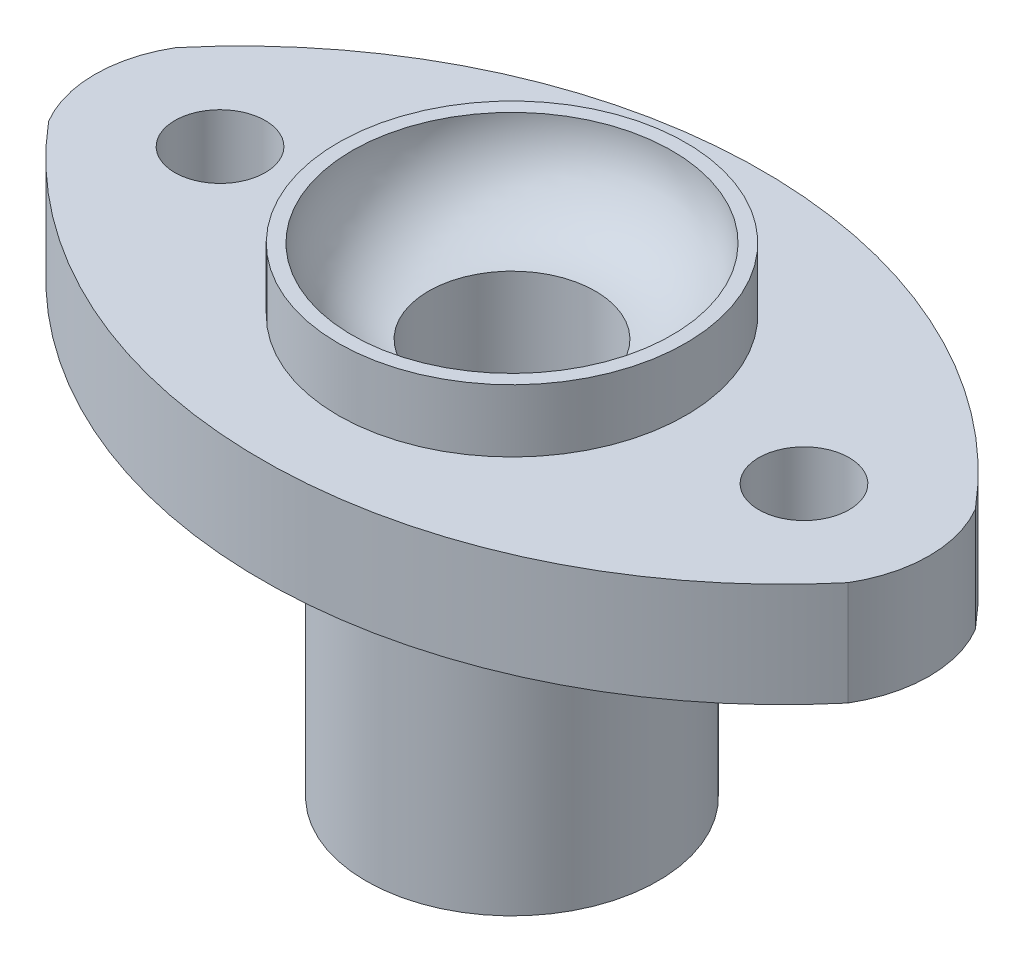
from build123d import *

# Parameters (mm, degrees)
SKETCH1_R           = 21
BOSS_EXTRUDE1_DEPTH = 45
SKETCH2_R           = 6.5
BOSS_EXTRUDE2_DEPTH = 15
SKETCH3_R           = 25
BOSS_EXTRUDE3_DEPTH = 9
CUT_EXTRUDE1_REACH  = 92.25
SKETCH5_R           = 12
CHAMFER1_SIZE       = 2.5
CHAMFER1_SIZE2      = 0.669872981


with BuildPart() as part:
    # Sketch1 → Boss-Extrude1 (new body)
    with BuildSketch(Plane(origin=(0, 0, 0), x_dir=(1, 0, 0), z_dir=(0, 1, 0))):
        with Locations(Location((0, 0, 0), (0, 0, 90))):
            Circle(SKETCH1_R)
    extrude(amount=BOSS_EXTRUDE1_DEPTH)

    # Sketch2 → Boss-Extrude2 (add)
    with BuildSketch(Plane(origin=(0, 45, 0), x_dir=(1, 0, 0), z_dir=(0, 1, 0))):
        with BuildLine():
            ThreePointArc((-57.496195447, -9.157943365), (-60, 0), (-57.496195447, 9.157943365))
            ThreePointArc((-57.496195447, 9.157943365), (0, 36), (57.496195447, 9.157943365))
            ThreePointArc((57.496195447, 9.157943365), (60, 0), (57.496195447, -9.157943365))
            ThreePointArc((57.496195447, -9.157943365), (0, -36), (-57.496195447, -9.157943365))
        make_face()
        with Locations(Location((-42, 0, 0), (0, 0, 270))):
            Circle(SKETCH2_R, mode=Mode.SUBTRACT)
        with Locations(Location((42, 0, 0), (0, 0, 90))):
            Circle(SKETCH2_R, mode=Mode.SUBTRACT)
    extrude(amount=BOSS_EXTRUDE2_DEPTH)

    # Sketch3 → Boss-Extrude3 (add)
    with BuildSketch(Plane(origin=(0, 60, 0), x_dir=(1, 0, 0), z_dir=(0, 1, 0))):
        with Locations(Location((0, 0, 0), (0, 0, 270))):
            Circle(SKETCH3_R)
    extrude(amount=BOSS_EXTRUDE3_DEPTH)

    # Sketch4 → Cut-Revolve1 (revolve, cut)
    with BuildSketch(Plane.XY):
        with BuildLine():
            Line((-12, 57), (0, 57))
            Line((0, 57), (0, 69))
            Line((0, 69), (-23, 69))
            ThreePointArc((-23, 69), (-19.845922252, 60.849571269), (-12, 57))
        make_face()
    revolve(axis=Axis((0, 69, 0), (0, -1, 0)), mode=Mode.SUBTRACT)

    # Sketch5 → Cut-Extrude1 (cut, up to next)
    with BuildSketch(Plane(origin=(0, 57, 0), x_dir=(1, 0, 0), z_dir=(0, 1, 0)), mode=Mode.PRIVATE) as cut_extrude1_sk1:
        with Locations(Location((0, 0, 0), (0, 0, 180))):
            Circle(SKETCH5_R)
    cut_extrude1_tool1 = extrude(cut_extrude1_sk1.sketch, amount=-CUT_EXTRUDE1_REACH, mode=Mode.PRIVATE) & part.part
    add(cut_extrude1_tool1.solids().sort_by_distance((0, 57, 0))[0], mode=Mode.SUBTRACT)

    # Chamfer1
    chamfer1_edges = [part.edges().sort_by_distance(p)[0] for p in [
        (12, 0, 0),
    ]]
    chamfer1_side = [part.faces().sort_by_distance(p)[0] for p in [
        (0, 0, 20.406030304),
    ]]
    chamfer(chamfer1_edges, length=CHAMFER1_SIZE, length2=CHAMFER1_SIZE2, reference=chamfer1_side[0])


solid = part.part
